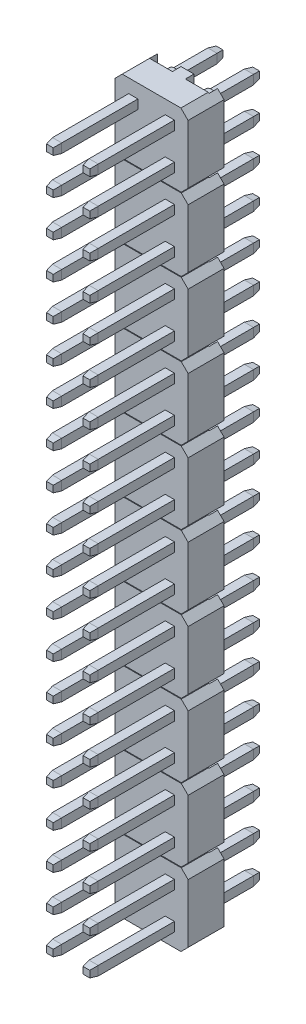
from build123d import *

# Parameters (mm, degrees)
SKETCH1_W                     = 0.64
SKETCH1_H                     = 0.64
BOSS_EXTRUDE1_DEPTH           = 5.3
BOSS_EXTRUDE1_2_DEPTH         = 5.3
BOSS_EXTRUDE1_3_DEPTH         = 5.3
BOSS_EXTRUDE1_4_DEPTH         = 5.3
SKETCH2_W                     = 0.64
SKETCH2_H                     = 0.64
BOSS_EXTRUDE2_DEPTH           = 0.5
BOSS_EXTRUDE2_DRAFT           = 10
BOSS_EXTRUDE2_PROFILE_2_DEPTH = 0.5
BOSS_EXTRUDE2_PROFILE_2_DRAFT = 10
BOSS_EXTRUDE2_PROFILE_3_DEPTH = 0.5
BOSS_EXTRUDE2_PROFILE_3_DRAFT = 10
BOSS_EXTRUDE2_PROFILE_4_DEPTH = 0.5
BOSS_EXTRUDE2_PROFILE_4_DRAFT = 10
BOSS_EXTRUDE3_DEPTH           = 2.5
SKETCH5_W                     = 1.64
SKETCH5_H                     = 5.08
CUT_EXTRUDE1_DEPTH            = 0.6
SKETCH8_W                     = 0.64
SKETCH8_H                     = 0.64
BOSS_EXTRUDE4_DEPTH           = 3.6
BOSS_EXTRUDE4_2_DEPTH         = 3.6
BOSS_EXTRUDE4_3_DEPTH         = 3.6
BOSS_EXTRUDE4_4_DEPTH         = 3.6
SKETCH9_W                     = 0.64
SKETCH9_H                     = 0.64
BOSS_EXTRUDE5_DEPTH           = 0.5
BOSS_EXTRUDE5_DRAFT           = 10
BOSS_EXTRUDE5_PROFILE_2_DEPTH = 0.5
BOSS_EXTRUDE5_PROFILE_2_DRAFT = 10
BOSS_EXTRUDE5_PROFILE_3_DEPTH = 0.5
BOSS_EXTRUDE5_PROFILE_3_DRAFT = 10
BOSS_EXTRUDE5_PROFILE_4_DEPTH = 0.5
BOSS_EXTRUDE5_PROFILE_4_DRAFT = 10
SKETCH10_R                    = 0.56
BOSS_EXTRUDE6_DEPTH           = 1
BOSS_EXTRUDE6_2_DEPTH         = 1
SZYK_LINIOWY1_COUNT           = 10
SZYK_LINIOWY1_PITCH           = 5.08
SZKIC1_W                      = 4.68427739
SZKIC1_H                      = 0.05
WYTNIJ_WYCI_GNI_CIE1_DEPTH    = 49.697835681


with BuildPart() as part:
    # Sketch1 → Boss-Extrude1 (new body)
    with BuildSketch(Plane.XY):
        with Locations((-1.27, 1.27)):
            Rectangle(SKETCH1_W, SKETCH1_H)
    extrude(amount=BOSS_EXTRUDE1_DEPTH)


with BuildPart() as body_2:
    # Sketch1 → Boss-Extrude1 2 (new body)
    with BuildSketch(Plane.XY):
        with Locations((-1.27, -1.27)):
            Rectangle(SKETCH1_W, SKETCH1_H)
    extrude(amount=BOSS_EXTRUDE1_2_DEPTH)


with BuildPart() as body_3:
    # Sketch1 → Boss-Extrude1 3 (new body)
    with BuildSketch(Plane.XY):
        with Locations((1.27, 1.27)):
            Rectangle(SKETCH1_W, SKETCH1_H)
    extrude(amount=BOSS_EXTRUDE1_3_DEPTH)


with BuildPart() as body_4:
    # Sketch1 → Boss-Extrude1 4 (new body)
    with BuildSketch(Plane.XY):
        with Locations((1.27, -1.27)):
            Rectangle(SKETCH1_W, SKETCH1_H)
    extrude(amount=BOSS_EXTRUDE1_4_DEPTH)


with BuildPart() as boss_extrude2_tool:
    # Sketch2 → Boss-Extrude2 (with draft: the straight prism first)
    with BuildSketch(Plane.XY.offset(5.3)):
        with Locations((-1.27, -1.27)):
            Rectangle(SKETCH2_W, SKETCH2_H)
    extrude(amount=BOSS_EXTRUDE2_DEPTH)
    # Boss-Extrude2: the draft: its side faces are tilted about the plane it starts from
    boss_extrude2_sides = [boss_extrude2_tool.faces().sort_by_distance(p)[0] for p in [
        (-1.59, -1.27, 5.55),
        (-1.27, -1.59, 5.55),
        (-0.95, -1.27, 5.55),
        (-1.27, -0.95, 5.55),
    ]]
    draft(boss_extrude2_sides, Plane.XY.offset(5.3), BOSS_EXTRUDE2_DRAFT)


with BuildPart() as part_1:
    add(part.part)

    # Boss-Extrude2: add boss_extrude2_tool
    add(boss_extrude2_tool.part)

    add(body_2.part)  # Boss-Extrude2 merges body 2

    add(body_3.part)  # Boss-Extrude2 merges body 3

    add(body_4.part)  # Boss-Extrude2 merges body 4


with BuildPart() as boss_extrude2_profile_2_tool:
    # Sketch2 → Boss-Extrude2 profile 2 (with draft: the straight prism first)
    with BuildSketch(Plane.XY.offset(5.3)):
        with Locations((-1.27, 1.27)):
            Rectangle(SKETCH2_W, SKETCH2_H)
    extrude(amount=BOSS_EXTRUDE2_PROFILE_2_DEPTH)
    # Boss-Extrude2 profile 2: the draft: its side faces are tilted about the plane it starts from
    boss_extrude2_profile_2_sides = [boss_extrude2_profile_2_tool.faces().sort_by_distance(p)[0] for p in [
        (-1.59, 1.27, 5.55),
        (-1.27, 0.95, 5.55),
        (-0.95, 1.27, 5.55),
        (-1.27, 1.59, 5.55),
    ]]
    draft(boss_extrude2_profile_2_sides, Plane.XY.offset(5.3), BOSS_EXTRUDE2_PROFILE_2_DRAFT)


with BuildPart() as part_2:
    add(part_1.part)

    # Boss-Extrude2 profile 2: add boss_extrude2_profile_2_tool
    add(boss_extrude2_profile_2_tool.part)


with BuildPart() as boss_extrude2_profile_3_tool:
    # Sketch2 → Boss-Extrude2 profile 3 (with draft: the straight prism first)
    with BuildSketch(Plane.XY.offset(5.3)):
        with Locations((1.27, -1.27)):
            Rectangle(SKETCH2_W, SKETCH2_H)
    extrude(amount=BOSS_EXTRUDE2_PROFILE_3_DEPTH)
    # Boss-Extrude2 profile 3: the draft: its side faces are tilted about the plane it starts from
    boss_extrude2_profile_3_sides = [boss_extrude2_profile_3_tool.faces().sort_by_distance(p)[0] for p in [
        (1.59, -1.27, 5.55),
        (1.27, -0.95, 5.55),
        (0.95, -1.27, 5.55),
        (1.27, -1.59, 5.55),
    ]]
    draft(boss_extrude2_profile_3_sides, Plane.XY.offset(5.3), BOSS_EXTRUDE2_PROFILE_3_DRAFT)


with BuildPart() as part_3:
    add(part_2.part)

    # Boss-Extrude2 profile 3: add boss_extrude2_profile_3_tool
    add(boss_extrude2_profile_3_tool.part)


with BuildPart() as boss_extrude2_profile_4_tool:
    # Sketch2 → Boss-Extrude2 profile 4 (with draft: the straight prism first)
    with BuildSketch(Plane.XY.offset(5.3)):
        with Locations((1.27, 1.27)):
            Rectangle(SKETCH2_W, SKETCH2_H)
    extrude(amount=BOSS_EXTRUDE2_PROFILE_4_DEPTH)
    # Boss-Extrude2 profile 4: the draft: its side faces are tilted about the plane it starts from
    boss_extrude2_profile_4_sides = [boss_extrude2_profile_4_tool.faces().sort_by_distance(p)[0] for p in [
        (1.59, 1.27, 5.55),
        (1.27, 1.59, 5.55),
        (0.95, 1.27, 5.55),
        (1.27, 0.95, 5.55),
    ]]
    draft(boss_extrude2_profile_4_sides, Plane.XY.offset(5.3), BOSS_EXTRUDE2_PROFILE_4_DRAFT)


with BuildPart() as part_4:
    add(part_3.part)

    # Boss-Extrude2 profile 4: add boss_extrude2_profile_4_tool
    add(boss_extrude2_profile_4_tool.part)


with BuildPart() as body_2_2:
    # Sketch3 → Boss-Extrude3 (new body)
    with BuildSketch(Plane.XY):
        Polygon((-2.04, 2.54), (2.04, 2.54), (2.54, 2.04), (2.54, -2.04), (2.04, -2.54), (-2.04, -2.54), (-2.54, -2.04), (-2.54, 2.04), align=None)
    extrude(amount=-BOSS_EXTRUDE3_DEPTH)

    # Sketch5 → Cut-Extrude1 (cut)
    with BuildSketch(Plane(origin=(0, 0, -2.5), x_dir=(-1, 0, 0), z_dir=(0, 0, -1))):
        with Locations((-1.27, 0)):
            Rectangle(SKETCH5_W, SKETCH5_H)
        with Locations((1.27, 0)):
            Rectangle(SKETCH5_W, SKETCH5_H)
    extrude(amount=-CUT_EXTRUDE1_DEPTH, mode=Mode.SUBTRACT)


with BuildPart() as body_3_2:
    # Sketch8 → Boss-Extrude4 (new body)
    with BuildSketch(Plane(origin=(0, 0, -1.9), x_dir=(-1, 0, 0), z_dir=(0, 0, -1))):
        with Locations((1.27, -1.27)):
            Rectangle(SKETCH8_W, SKETCH8_H)
    extrude(amount=BOSS_EXTRUDE4_DEPTH)


with BuildPart() as body_4_2:
    # Sketch8 → Boss-Extrude4 2 (new body)
    with BuildSketch(Plane(origin=(0, 0, -1.9), x_dir=(-1, 0, 0), z_dir=(0, 0, -1))):
        with Locations((1.27, 1.27)):
            Rectangle(SKETCH8_W, SKETCH8_H)
    extrude(amount=BOSS_EXTRUDE4_2_DEPTH)


with BuildPart() as body_5:
    # Sketch8 → Boss-Extrude4 3 (new body)
    with BuildSketch(Plane(origin=(0, 0, -1.9), x_dir=(-1, 0, 0), z_dir=(0, 0, -1))):
        with Locations((-1.27, 1.27)):
            Rectangle(SKETCH8_W, SKETCH8_H)
    extrude(amount=BOSS_EXTRUDE4_3_DEPTH)


with BuildPart() as body_6:
    # Sketch8 → Boss-Extrude4 4 (new body)
    with BuildSketch(Plane(origin=(0, 0, -1.9), x_dir=(-1, 0, 0), z_dir=(0, 0, -1))):
        with Locations((-1.27, -1.27)):
            Rectangle(SKETCH8_W, SKETCH8_H)
    extrude(amount=BOSS_EXTRUDE4_4_DEPTH)


with BuildPart() as boss_extrude5_tool:
    # Sketch9 → Boss-Extrude5 (with draft: the straight prism first)
    with BuildSketch(Plane(origin=(0, 0, -5.5), x_dir=(-1, 0, 0), z_dir=(0, 0, -1))):
        with Locations((1.27, 1.27)):
            Rectangle(SKETCH9_W, SKETCH9_H)
    extrude(amount=BOSS_EXTRUDE5_DEPTH)
    # Boss-Extrude5: the draft: its side faces are tilted about the plane it starts from
    boss_extrude5_sides = [boss_extrude5_tool.faces().sort_by_distance(p)[0] for p in [
        (-0.95, 1.27, -5.75),
        (-1.27, 0.95, -5.75),
        (-1.59, 1.27, -5.75),
        (-1.27, 1.59, -5.75),
    ]]
    draft(boss_extrude5_sides, Plane(origin=(0, 0, -5.5), x_dir=(-1, 0, 0), z_dir=(0, 0, -1)), BOSS_EXTRUDE5_DRAFT)


with BuildPart() as body_4_2_1:
    add(body_4_2.part)

    # Boss-Extrude5: add boss_extrude5_tool
    add(boss_extrude5_tool.part)

    add(body_3_2.part)  # Boss-Extrude5 merges body 3 2

    add(body_6.part)  # Boss-Extrude5 merges body 6

    add(body_5.part)  # Boss-Extrude5 merges body 5


with BuildPart() as boss_extrude5_profile_2_tool:
    # Sketch9 → Boss-Extrude5 profile 2 (with draft: the straight prism first)
    with BuildSketch(Plane(origin=(0, 0, -5.5), x_dir=(-1, 0, 0), z_dir=(0, 0, -1))):
        with Locations((1.27, -1.27)):
            Rectangle(SKETCH9_W, SKETCH9_H)
    extrude(amount=BOSS_EXTRUDE5_PROFILE_2_DEPTH)
    # Boss-Extrude5 profile 2: the draft: its side faces are tilted about the plane it starts from
    boss_extrude5_profile_2_sides = [boss_extrude5_profile_2_tool.faces().sort_by_distance(p)[0] for p in [
        (-1.59, -1.27, -5.75),
        (-1.27, -0.95, -5.75),
        (-0.95, -1.27, -5.75),
        (-1.27, -1.59, -5.75),
    ]]
    draft(boss_extrude5_profile_2_sides, Plane(origin=(0, 0, -5.5), x_dir=(-1, 0, 0), z_dir=(0, 0, -1)), BOSS_EXTRUDE5_PROFILE_2_DRAFT)


with BuildPart() as body_4_2_2:
    add(body_4_2_1.part)

    # Boss-Extrude5 profile 2: add boss_extrude5_profile_2_tool
    add(boss_extrude5_profile_2_tool.part)


with BuildPart() as boss_extrude5_profile_3_tool:
    # Sketch9 → Boss-Extrude5 profile 3 (with draft: the straight prism first)
    with BuildSketch(Plane(origin=(0, 0, -5.5), x_dir=(-1, 0, 0), z_dir=(0, 0, -1))):
        with Locations((-1.27, -1.27)):
            Rectangle(SKETCH9_W, SKETCH9_H)
    extrude(amount=BOSS_EXTRUDE5_PROFILE_3_DEPTH)
    # Boss-Extrude5 profile 3: the draft: its side faces are tilted about the plane it starts from
    boss_extrude5_profile_3_sides = [boss_extrude5_profile_3_tool.faces().sort_by_distance(p)[0] for p in [
        (1.59, -1.27, -5.75),
        (1.27, -1.59, -5.75),
        (0.95, -1.27, -5.75),
        (1.27, -0.95, -5.75),
    ]]
    draft(boss_extrude5_profile_3_sides, Plane(origin=(0, 0, -5.5), x_dir=(-1, 0, 0), z_dir=(0, 0, -1)), BOSS_EXTRUDE5_PROFILE_3_DRAFT)


with BuildPart() as body_4_2_3:
    add(body_4_2_2.part)

    # Boss-Extrude5 profile 3: add boss_extrude5_profile_3_tool
    add(boss_extrude5_profile_3_tool.part)


with BuildPart() as boss_extrude5_profile_4_tool:
    # Sketch9 → Boss-Extrude5 profile 4 (with draft: the straight prism first)
    with BuildSketch(Plane(origin=(0, 0, -5.5), x_dir=(-1, 0, 0), z_dir=(0, 0, -1))):
        with Locations((-1.27, 1.27)):
            Rectangle(SKETCH9_W, SKETCH9_H)
    extrude(amount=BOSS_EXTRUDE5_PROFILE_4_DEPTH)
    # Boss-Extrude5 profile 4: the draft: its side faces are tilted about the plane it starts from
    boss_extrude5_profile_4_sides = [boss_extrude5_profile_4_tool.faces().sort_by_distance(p)[0] for p in [
        (0.95, 1.27, -5.75),
        (1.27, 1.59, -5.75),
        (1.59, 1.27, -5.75),
        (1.27, 0.95, -5.75),
    ]]
    draft(boss_extrude5_profile_4_sides, Plane(origin=(0, 0, -5.5), x_dir=(-1, 0, 0), z_dir=(0, 0, -1)), BOSS_EXTRUDE5_PROFILE_4_DRAFT)


with BuildPart() as body_4_2_4:
    add(body_4_2_3.part)

    # Boss-Extrude5 profile 4: add boss_extrude5_profile_4_tool
    add(boss_extrude5_profile_4_tool.part)


with BuildPart() as body_4_3:
    # Sketch10 → Boss-Extrude6 (new body)
    with BuildSketch(Plane(origin=(0, 0, -1.9), x_dir=(-1, 0, 0), z_dir=(0, 0, -1))):
        with Locations((-1.27, 1.27)):
            Circle(SKETCH10_R)
    extrude(amount=BOSS_EXTRUDE6_DEPTH)


with BuildPart() as body_5_2:
    # Sketch10 → Boss-Extrude6 2 (new body)
    with BuildSketch(Plane(origin=(0, 0, -1.9), x_dir=(-1, 0, 0), z_dir=(0, 0, -1))):
        with Locations((1.27, 1.27)):
            Circle(SKETCH10_R)
    extrude(amount=BOSS_EXTRUDE6_2_DEPTH)


with BuildPart() as szyk_liniowy1_1:
    # Szyk liniowy1: pattern copy
    add(body_2_2.part.moved(Location(Vector(0, -1, 0) * (1 * SZYK_LINIOWY1_PITCH))))


with BuildPart() as szyk_liniowy1_2:
    # Szyk liniowy1: pattern copy
    add(body_2_2.part.moved(Location(Vector(0, -1, 0) * (2 * SZYK_LINIOWY1_PITCH))))


with BuildPart() as szyk_liniowy1_3:
    # Szyk liniowy1: pattern copy
    add(body_2_2.part.moved(Location(Vector(0, -1, 0) * (3 * SZYK_LINIOWY1_PITCH))))


with BuildPart() as szyk_liniowy1_4:
    # Szyk liniowy1: pattern copy
    add(body_2_2.part.moved(Location(Vector(0, -1, 0) * (4 * SZYK_LINIOWY1_PITCH))))


with BuildPart() as szyk_liniowy1_5:
    # Szyk liniowy1: pattern copy
    add(body_2_2.part.moved(Location(Vector(0, -1, 0) * (5 * SZYK_LINIOWY1_PITCH))))


with BuildPart() as szyk_liniowy1_6:
    # Szyk liniowy1: pattern copy
    add(body_2_2.part.moved(Location(Vector(0, -1, 0) * (6 * SZYK_LINIOWY1_PITCH))))


with BuildPart() as szyk_liniowy1_7:
    # Szyk liniowy1: pattern copy
    add(body_2_2.part.moved(Location(Vector(0, -1, 0) * (7 * SZYK_LINIOWY1_PITCH))))


with BuildPart() as szyk_liniowy1_8:
    # Szyk liniowy1: pattern copy
    add(body_2_2.part.moved(Location(Vector(0, -1, 0) * (8 * SZYK_LINIOWY1_PITCH))))


with BuildPart() as szyk_liniowy1_9:
    # Szyk liniowy1: pattern copy
    add(body_2_2.part.moved(Location(Vector(0, -1, 0) * (9 * SZYK_LINIOWY1_PITCH))))


with BuildPart() as szyk_liniowy1_10:
    # Szyk liniowy1: pattern copy
    add(part_4.part.moved(Location(Vector(0, -1, 0) * (1 * SZYK_LINIOWY1_PITCH))))


with BuildPart() as szyk_liniowy1_11:
    # Szyk liniowy1: pattern copy
    add(part_4.part.moved(Location(Vector(0, -1, 0) * (2 * SZYK_LINIOWY1_PITCH))))


with BuildPart() as szyk_liniowy1_12:
    # Szyk liniowy1: pattern copy
    add(part_4.part.moved(Location(Vector(0, -1, 0) * (3 * SZYK_LINIOWY1_PITCH))))


with BuildPart() as szyk_liniowy1_13:
    # Szyk liniowy1: pattern copy
    add(part_4.part.moved(Location(Vector(0, -1, 0) * (4 * SZYK_LINIOWY1_PITCH))))


with BuildPart() as szyk_liniowy1_14:
    # Szyk liniowy1: pattern copy
    add(part_4.part.moved(Location(Vector(0, -1, 0) * (5 * SZYK_LINIOWY1_PITCH))))


with BuildPart() as szyk_liniowy1_15:
    # Szyk liniowy1: pattern copy
    add(part_4.part.moved(Location(Vector(0, -1, 0) * (6 * SZYK_LINIOWY1_PITCH))))


with BuildPart() as szyk_liniowy1_16:
    # Szyk liniowy1: pattern copy
    add(part_4.part.moved(Location(Vector(0, -1, 0) * (7 * SZYK_LINIOWY1_PITCH))))


with BuildPart() as szyk_liniowy1_17:
    # Szyk liniowy1: pattern copy
    add(part_4.part.moved(Location(Vector(0, -1, 0) * (8 * SZYK_LINIOWY1_PITCH))))


with BuildPart() as szyk_liniowy1_18:
    # Szyk liniowy1: pattern copy
    add(part_4.part.moved(Location(Vector(0, -1, 0) * (9 * SZYK_LINIOWY1_PITCH))))


with BuildPart() as szyk_liniowy1_19:
    # Szyk liniowy1: pattern copy
    add(body_4_2_4.part.moved(Location(Vector(0, -1, 0) * (1 * SZYK_LINIOWY1_PITCH))))


with BuildPart() as szyk_liniowy1_20:
    # Szyk liniowy1: pattern copy
    add(body_4_2_4.part.moved(Location(Vector(0, -1, 0) * (2 * SZYK_LINIOWY1_PITCH))))


with BuildPart() as szyk_liniowy1_21:
    # Szyk liniowy1: pattern copy
    add(body_4_2_4.part.moved(Location(Vector(0, -1, 0) * (3 * SZYK_LINIOWY1_PITCH))))


with BuildPart() as szyk_liniowy1_22:
    # Szyk liniowy1: pattern copy
    add(body_4_2_4.part.moved(Location(Vector(0, -1, 0) * (4 * SZYK_LINIOWY1_PITCH))))


with BuildPart() as szyk_liniowy1_23:
    # Szyk liniowy1: pattern copy
    add(body_4_2_4.part.moved(Location(Vector(0, -1, 0) * (5 * SZYK_LINIOWY1_PITCH))))


with BuildPart() as szyk_liniowy1_24:
    # Szyk liniowy1: pattern copy
    add(body_4_2_4.part.moved(Location(Vector(0, -1, 0) * (6 * SZYK_LINIOWY1_PITCH))))


with BuildPart() as szyk_liniowy1_25:
    # Szyk liniowy1: pattern copy
    add(body_4_2_4.part.moved(Location(Vector(0, -1, 0) * (7 * SZYK_LINIOWY1_PITCH))))


with BuildPart() as szyk_liniowy1_26:
    # Szyk liniowy1: pattern copy
    add(body_4_2_4.part.moved(Location(Vector(0, -1, 0) * (8 * SZYK_LINIOWY1_PITCH))))


with BuildPart() as szyk_liniowy1_27:
    # Szyk liniowy1: pattern copy
    add(body_4_2_4.part.moved(Location(Vector(0, -1, 0) * (9 * SZYK_LINIOWY1_PITCH))))


with BuildPart() as wytnij_wyci_gni_cie1_tool:
    # Szkic1 → Wytnij-wyciągnięcie1 (new, through all)
    with BuildSketch(Plane.XY):
        with Locations((0, -7.62)):
            Rectangle(SZKIC1_W, SZKIC1_H)
        with Locations((0, -2.54)):
            Rectangle(SZKIC1_W, SZKIC1_H)
        with Locations((0, -12.7)):
            Rectangle(SZKIC1_W, SZKIC1_H)
        with Locations((0, -17.78)):
            Rectangle(SZKIC1_W, SZKIC1_H)
        with Locations((0, -22.86)):
            Rectangle(SZKIC1_W, SZKIC1_H)
        with Locations((0, -27.94)):
            Rectangle(SZKIC1_W, SZKIC1_H)
        with Locations((0, -33.02)):
            Rectangle(SZKIC1_W, SZKIC1_H)
        with Locations((0, -38.1)):
            Rectangle(SZKIC1_W, SZKIC1_H)
        with Locations((0, -43.18)):
            Rectangle(SZKIC1_W, SZKIC1_H)
    extrude(amount=-WYTNIJ_WYCI_GNI_CIE1_DEPTH)


with BuildPart() as body_2_2_1:
    add(body_2_2.part)

    # Wytnij-wyciągnięcie1: cut by wytnij_wyci_gni_cie1_tool
    add(wytnij_wyci_gni_cie1_tool.part, mode=Mode.SUBTRACT)


with BuildPart() as szyk_liniowy1_1_1:
    add(szyk_liniowy1_1.part)

    # Wytnij-wyciągnięcie1: cut by wytnij_wyci_gni_cie1_tool
    add(wytnij_wyci_gni_cie1_tool.part, mode=Mode.SUBTRACT)


with BuildPart() as szyk_liniowy1_2_1:
    add(szyk_liniowy1_2.part)

    # Wytnij-wyciągnięcie1: cut by wytnij_wyci_gni_cie1_tool
    add(wytnij_wyci_gni_cie1_tool.part, mode=Mode.SUBTRACT)


with BuildPart() as szyk_liniowy1_3_1:
    add(szyk_liniowy1_3.part)

    # Wytnij-wyciągnięcie1: cut by wytnij_wyci_gni_cie1_tool
    add(wytnij_wyci_gni_cie1_tool.part, mode=Mode.SUBTRACT)


with BuildPart() as szyk_liniowy1_4_1:
    add(szyk_liniowy1_4.part)

    # Wytnij-wyciągnięcie1: cut by wytnij_wyci_gni_cie1_tool
    add(wytnij_wyci_gni_cie1_tool.part, mode=Mode.SUBTRACT)


with BuildPart() as szyk_liniowy1_5_1:
    add(szyk_liniowy1_5.part)

    # Wytnij-wyciągnięcie1: cut by wytnij_wyci_gni_cie1_tool
    add(wytnij_wyci_gni_cie1_tool.part, mode=Mode.SUBTRACT)


with BuildPart() as szyk_liniowy1_6_1:
    add(szyk_liniowy1_6.part)

    # Wytnij-wyciągnięcie1: cut by wytnij_wyci_gni_cie1_tool
    add(wytnij_wyci_gni_cie1_tool.part, mode=Mode.SUBTRACT)


with BuildPart() as szyk_liniowy1_7_1:
    add(szyk_liniowy1_7.part)

    # Wytnij-wyciągnięcie1: cut by wytnij_wyci_gni_cie1_tool
    add(wytnij_wyci_gni_cie1_tool.part, mode=Mode.SUBTRACT)


with BuildPart() as szyk_liniowy1_8_1:
    add(szyk_liniowy1_8.part)

    # Wytnij-wyciągnięcie1: cut by wytnij_wyci_gni_cie1_tool
    add(wytnij_wyci_gni_cie1_tool.part, mode=Mode.SUBTRACT)


with BuildPart() as szyk_liniowy1_9_1:
    add(szyk_liniowy1_9.part)

    # Wytnij-wyciągnięcie1: cut by wytnij_wyci_gni_cie1_tool
    add(wytnij_wyci_gni_cie1_tool.part, mode=Mode.SUBTRACT)


solid = Compound([part_4.part, body_4_2_4.part, body_4_3.part, body_5_2.part, szyk_liniowy1_10.part, szyk_liniowy1_11.part, szyk_liniowy1_12.part, szyk_liniowy1_13.part, szyk_liniowy1_14.part, szyk_liniowy1_15.part, szyk_liniowy1_16.part, szyk_liniowy1_17.part, szyk_liniowy1_18.part, szyk_liniowy1_19.part, szyk_liniowy1_20.part, szyk_liniowy1_21.part, szyk_liniowy1_22.part, szyk_liniowy1_23.part, szyk_liniowy1_24.part, szyk_liniowy1_25.part, szyk_liniowy1_26.part, szyk_liniowy1_27.part, body_2_2_1.part, szyk_liniowy1_1_1.part, szyk_liniowy1_2_1.part, szyk_liniowy1_3_1.part, szyk_liniowy1_4_1.part, szyk_liniowy1_5_1.part, szyk_liniowy1_6_1.part, szyk_liniowy1_7_1.part, szyk_liniowy1_8_1.part, szyk_liniowy1_9_1.part])
